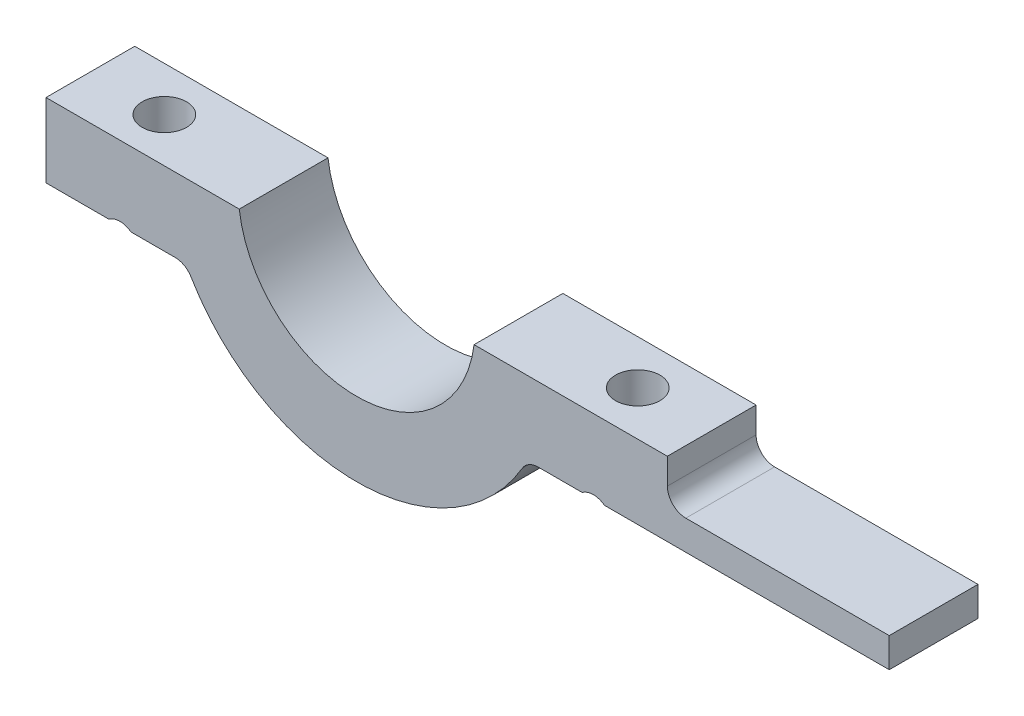
from build123d import *

# Parameters (mm, degrees)
EXTRUDE_1_DEPTH     = 3
SKETCH_3_R          = 1.5
CUT_EXTRUDE_1_DEPTH = 37.796738986
SKETCH_4_W          = 15
SKETCH_4_H          = 3
CUT_EXTRUDE_2_DEPTH = 39.742741271
FILLET_1_R          = 1.25


with BuildPart() as part:
    # ｽｹｯﾁ1 → ﾎﾞｽ - 押し出し1 (new, symmetric)
    with BuildSketch(Plane.XY):
        with BuildLine():
            Line((-15.25, -6), (-11.532562595, -6))
            ThreePointArc((-11.532562595, -6), (0, -13), (11.532562595, -6))
            Line((11.532562595, -6), (15.25, -6))
            ThreePointArc((15.25, -6), (16, -5.75), (16.75, -6))
            Line((16.75, -6), (36, -6))
            Line((36, -6), (36, -1))
            Line((36, -1), (7.937253933, -1))
            ThreePointArc((7.937253933, -1), (0, -8), (-7.937253933, -1))
            Line((-7.937253933, -1), (-21, -1))
            Line((-21, -1), (-21, -6))
            Line((-21, -6), (-16.75, -6))
            ThreePointArc((-16.75, -6), (-16, -5.75), (-15.25, -6))
        make_face()
    extrude(amount=EXTRUDE_1_DEPTH, both=True)

    # ｽｹｯﾁ3 → ｶｯﾄ - 押し出し1 (cut, through all)
    with BuildSketch(Plane.XZ.offset(6)):
        with Locations((-16, 0)):
            Circle(SKETCH_3_R)
        with Locations((16, 0)):
            Circle(SKETCH_3_R)
    extrude(amount=-CUT_EXTRUDE_1_DEPTH, mode=Mode.SUBTRACT)

    # ｽｹｯﾁ4 → ｶｯﾄ - 押し出し2 (cut, through all)
    with BuildSketch(Plane.XY.offset(3)):
        with Locations((28.5, -2.5)):
            Rectangle(SKETCH_4_W, SKETCH_4_H)
    extrude(amount=-CUT_EXTRUDE_2_DEPTH, mode=Mode.SUBTRACT)

    # ﾌｨﾚｯﾄ1
    fillet_1_edges = [part.edges().sort_by_distance(p)[0] for p in [
        (11.532562595, -6, 0),
        (-11.532562595, -6, 0),
        (21, -4, 0),
    ]]
    fillet(fillet_1_edges, radius=FILLET_1_R)


solid = part.part
